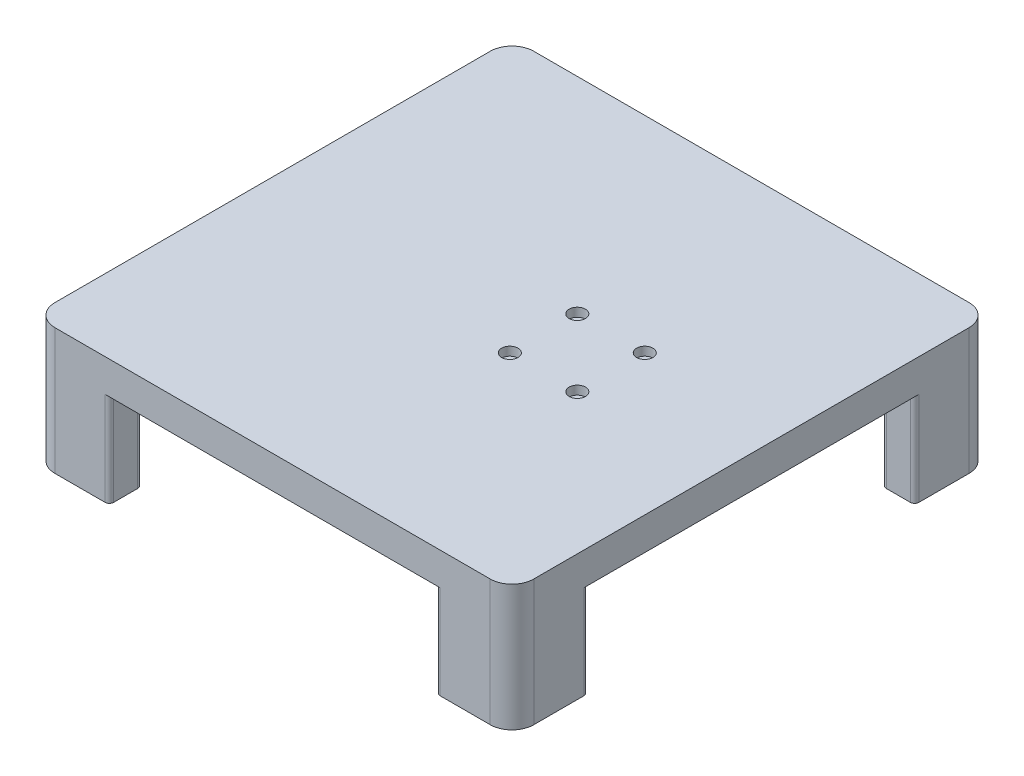
from build123d import *

# Parameters (mm, degrees)
SKETCH1_W           = 220
SKETCH1_H           = 220
SKETCH1_R           = 1.75
BOSS_EXTRUDE1_DEPTH = 15
FILLET1_R           = 10
BOSS_EXTRUDE2_DEPTH = 43
CUT_EXTRUDE1_DEPTH  = 31
FILLET2_R           = 2
SKETCH5_R           = 3.75
CUT_EXTRUDE2_DEPTH  = 4


with BuildPart() as part:
    # Sketch1 → Boss-Extrude1 (new body)
    with BuildSketch(Plane(origin=(0, 0, 0), x_dir=(1, 0, 0), z_dir=(0, 1, 0))):
        Rectangle(SKETCH1_W, SKETCH1_H)
        with Locations(Location((45.5, 15.5, 0), (0, 0, 270))):
            Circle(SKETCH1_R, mode=Mode.SUBTRACT)
        with Locations(Location((45.5, -15.5, 0), (0, 0, 90))):
            Circle(SKETCH1_R, mode=Mode.SUBTRACT)
        with Locations(Location((14.5, -15.5, 0), (0, 0, 270))):
            Circle(SKETCH1_R, mode=Mode.SUBTRACT)
        with Locations(Location((14.5, 15.5, 0), (0, 0, 90))):
            Circle(SKETCH1_R, mode=Mode.SUBTRACT)
    extrude(amount=BOSS_EXTRUDE1_DEPTH)

    # Fillet1
    fillet1_edges = [part.edges().sort_by_distance(p)[0] for p in [
        (110, 7.5, 110),
        (-110, 7.5, 110),
        (-110, 7.5, -110),
        (110, 7.5, -110),
    ]]
    fillet(fillet1_edges, radius=FILLET1_R)

    # Sketch2 → Boss-Extrude2 (add)
    with BuildSketch(Plane.XZ):
        with BuildLine():
            Line((-75, 95), (-85, 95))
            ThreePointArc((-85, 95), (-92.071067812, 92.071067812), (-95, 85))
            Line((-95, 85), (-95, 75))
            Line((-95, 75), (-110, 75))
            Line((-110, 75), (-110, 100))
            ThreePointArc((-110, 100), (-107.071067812, 107.071067812), (-100, 110))
            Line((-100, 110), (-75, 110))
            Line((-75, 110), (-75, 95))
        make_face()
        with BuildLine():
            Line((-75, -95), (-75, -110))
            Line((-75, -110), (-100, -110))
            ThreePointArc((-100, -110), (-107.071067812, -107.071067812), (-110, -100))
            Line((-110, -100), (-110, -75))
            Line((-110, -75), (-95, -75))
            Line((-95, -75), (-95, -85))
            ThreePointArc((-95, -85), (-92.071067812, -92.071067812), (-85, -95))
            Line((-85, -95), (-75, -95))
        make_face()
        with BuildLine():
            Line((75, -95), (85, -95))
            ThreePointArc((85, -95), (92.071067812, -92.071067812), (95, -85))
            Line((95, -85), (95, -75))
            Line((95, -75), (110, -75))
            Line((110, -75), (110, -100))
            ThreePointArc((110, -100), (107.071067812, -107.071067812), (100, -110))
            Line((100, -110), (75, -110))
            Line((75, -110), (75, -95))
        make_face()
        with BuildLine():
            Line((75, 95), (75, 110))
            Line((75, 110), (100, 110))
            ThreePointArc((100, 110), (107.071067812, 107.071067812), (110, 100))
            Line((110, 100), (110, 75))
            Line((110, 75), (95, 75))
            Line((95, 75), (95, 85))
            ThreePointArc((95, 85), (92.071067812, 92.071067812), (85, 95))
            Line((85, 95), (75, 95))
        make_face()
    extrude(amount=BOSS_EXTRUDE2_DEPTH)

    # Sketch3 → Cut-Extrude1 (cut)
    with BuildSketch(Plane.XZ.offset(43)):
        with BuildLine():
            ThreePointArc((-106.325, -85), (-100.079052109, -100.079052109), (-85, -106.325))
            ThreePointArc((-85, -106.325), (-81.675, -103), (-85, -99.675))
            ThreePointArc((-85, -99.675), (-95.376792014, -95.376792014), (-99.675, -85))
            ThreePointArc((-99.675, -85), (-103, -81.675), (-106.325, -85))
        make_face()
        with BuildLine():
            ThreePointArc((-85, 106.325), (-100.079052109, 100.079052109), (-106.325, 85))
            ThreePointArc((-106.325, 85), (-103, 81.675), (-99.675, 85))
            ThreePointArc((-99.675, 85), (-95.376792014, 95.376792014), (-85, 99.675))
            ThreePointArc((-85, 99.675), (-81.675, 103), (-85, 106.325))
        make_face()
        with BuildLine():
            ThreePointArc((106.325, 85), (100.079052109, 100.079052109), (85, 106.325))
            ThreePointArc((85, 106.325), (81.675, 103), (85, 99.675))
            ThreePointArc((85, 99.675), (95.376792014, 95.376792014), (99.675, 85))
            ThreePointArc((99.675, 85), (103, 81.675), (106.325, 85))
        make_face()
        with BuildLine():
            ThreePointArc((85, -106.325), (100.079052109, -100.079052109), (106.325, -85))
            ThreePointArc((106.325, -85), (103, -81.675), (99.675, -85))
            ThreePointArc((99.675, -85), (95.376792014, -95.376792014), (85, -99.675))
            ThreePointArc((85, -99.675), (81.675, -103), (85, -106.325))
        make_face()
    extrude(amount=-CUT_EXTRUDE1_DEPTH, mode=Mode.SUBTRACT)

    # Fillet2
    fillet2_edges = [part.edges().sort_by_distance(p)[0] for p in [
        (-75, -21.5, -95),
        (-95, -21.5, -75),
        (-110, -21.5, -75),
        (-75, -21.5, -110),
        (75, -21.5, 95),
        (95, -21.5, 75),
        (110, -21.5, 75),
        (75, -21.5, 110),
        (-110, -21.5, 75),
        (-95, -21.5, 75),
        (-75, -21.5, 95),
        (-75, -21.5, 110),
        (110, -21.5, -75),
        (95, -21.5, -75),
        (75, -21.5, -95),
        (75, -21.5, -110),
    ]]
    fillet(fillet2_edges, radius=FILLET2_R)

    # Sketch5 → Cut-Extrude2 (cut)
    with BuildSketch(Plane(origin=(0, 15, 0), x_dir=(1, 0, 0), z_dir=(0, 1, 0))):
        with Locations(Location((14.5, 15.5, 0), (0, 0, 270))):
            Circle(SKETCH5_R)
        with Locations(Location((45.5, 15.5, 0), (0, 0, 270))):
            Circle(SKETCH5_R)
        with Locations(Location((14.5, -15.5, 0), (0, 0, 270))):
            Circle(SKETCH5_R)
        with Locations(Location((45.5, -15.5, 0), (0, 0, 270))):
            Circle(SKETCH5_R)
    extrude(amount=-CUT_EXTRUDE2_DEPTH, mode=Mode.SUBTRACT)


solid = part.part
